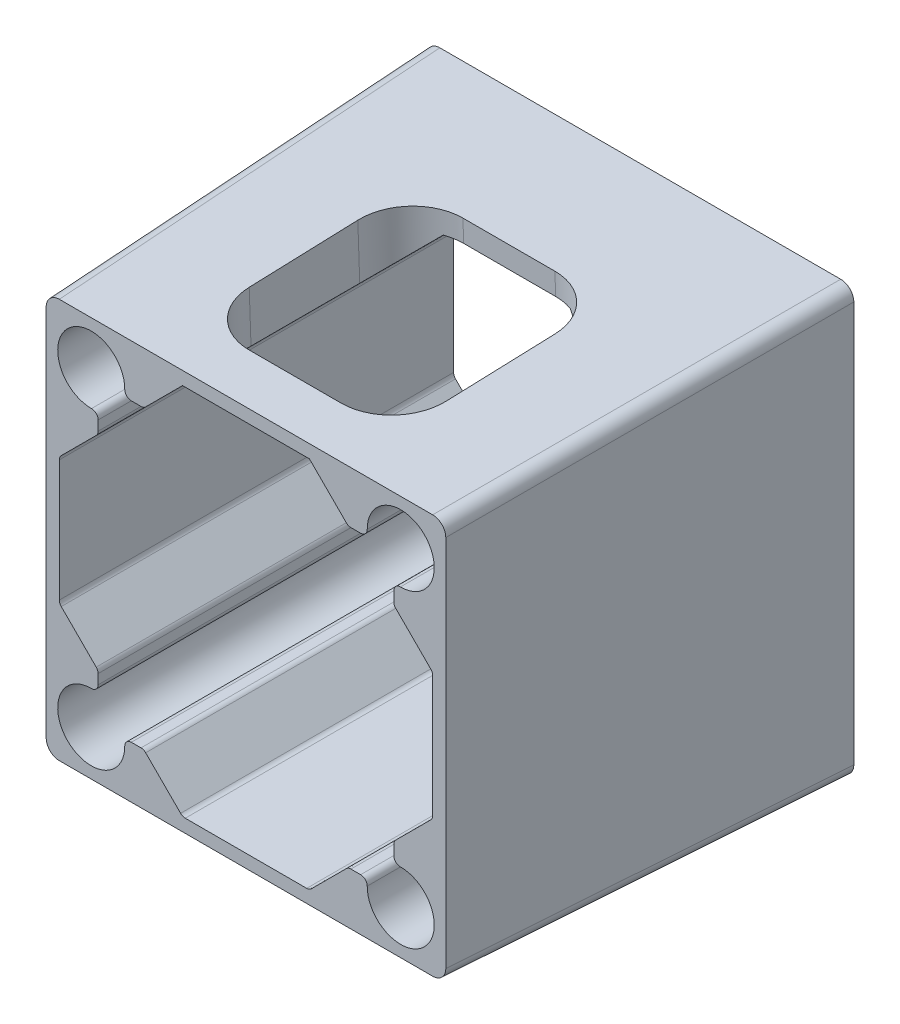
from build123d import *

# Parameters (mm, degrees)
SKETCH1_W           = 65
SKETCH1_H           = 65
BOSS_EXTRUDE1_DEPTH = 60
BOSS_EXTRUDE1_TAPER = 2
CUT_EXTRUDE1_REACH  = 77.581
SKETCH4_R           = 5.1
CUT_EXTRUDE2_REACH  = 77.581
SKETCH5_W           = 45
SKETCH5_H           = 45
CUT_EXTRUDE4_REACH  = 77.581
CUT_EXTRUDE5_REACH  = 95.495
SKETCH7_W           = 30
SKETCH7_H           = 32.536572658
FILLET1_R           = 2
FILLET3_R           = 1
FILLET5_R           = 8


with BuildPart() as part:
    # Sketch1 → Boss-Extrude1 (new body)
    with BuildSketch(Plane.XY):
        Rectangle(SKETCH1_W, SKETCH1_H)
    extrude(amount=BOSS_EXTRUDE1_DEPTH, taper=BOSS_EXTRUDE1_TAPER)

    # Sketch4 → Cut-Extrude1 (cut, up to next)
    with BuildSketch(Plane.XY.offset(60), mode=Mode.PRIVATE) as cut_extrude1_sk1:
        with Locations((-23.550191347, 23.550191347)):
            Circle(SKETCH4_R)
    cut_extrude1_tool1 = extrude(cut_extrude1_sk1.sketch, amount=-CUT_EXTRUDE1_REACH, mode=Mode.PRIVATE) & part.part
    # Sketch4 → Cut-Extrude1 (cut, up to next)
    with BuildSketch(Plane.XY.offset(60), mode=Mode.PRIVATE) as cut_extrude1_sk2:
        with Locations((23.550191347, 23.550191347)):
            Circle(SKETCH4_R)
    cut_extrude1_tool2 = extrude(cut_extrude1_sk2.sketch, amount=-CUT_EXTRUDE1_REACH, mode=Mode.PRIVATE) & part.part
    # Sketch4 → Cut-Extrude1 (cut, up to next)
    with BuildSketch(Plane.XY.offset(60), mode=Mode.PRIVATE) as cut_extrude1_sk3:
        with Locations((23.550191347, -23.550191347)):
            Circle(SKETCH4_R)
    cut_extrude1_tool3 = extrude(cut_extrude1_sk3.sketch, amount=-CUT_EXTRUDE1_REACH, mode=Mode.PRIVATE) & part.part
    # Sketch4 → Cut-Extrude1 (cut, up to next)
    with BuildSketch(Plane.XY.offset(60), mode=Mode.PRIVATE) as cut_extrude1_sk4:
        with Locations((-23.550191347, -23.550191347)):
            Circle(SKETCH4_R)
    cut_extrude1_tool4 = extrude(cut_extrude1_sk4.sketch, amount=-CUT_EXTRUDE1_REACH, mode=Mode.PRIVATE) & part.part
    add(cut_extrude1_tool1.solids().sort_by_distance((-23.550191, 23.550191, 60))[0], mode=Mode.SUBTRACT)
    add(cut_extrude1_tool2.solids().sort_by_distance((23.550191, 23.550191, 60))[0], mode=Mode.SUBTRACT)
    add(cut_extrude1_tool3.solids().sort_by_distance((23.550191, -23.550191, 60))[0], mode=Mode.SUBTRACT)
    add(cut_extrude1_tool4.solids().sort_by_distance((-23.550191, -23.550191, 60))[0], mode=Mode.SUBTRACT)

    # Sketch5 → Cut-Extrude2 (cut, up to next)
    with BuildSketch(Plane.XY.offset(60), mode=Mode.PRIVATE) as cut_extrude2_sk1:
        Rectangle(SKETCH5_W, SKETCH5_H)
    cut_extrude2_tool1 = extrude(cut_extrude2_sk1.sketch, amount=-CUT_EXTRUDE2_REACH, mode=Mode.PRIVATE) & part.part
    add(cut_extrude2_tool1.solids().sort_by_distance((0, 0, 60))[0], mode=Mode.SUBTRACT)

    # Sketch6 → Cut-Extrude4 (cut, up to next)
    with BuildSketch(Plane.XY.offset(60), mode=Mode.PRIVATE) as cut_extrude4_sk1:
        Polygon((-22.5, -15.559490181), (-22.5, 15.559490181), (-28.40475383, 9.65473635), (-28.40475383, -9.65473635), align=None)
    cut_extrude4_tool1 = extrude(cut_extrude4_sk1.sketch, amount=-CUT_EXTRUDE4_REACH, mode=Mode.PRIVATE) & part.part
    # Sketch6 → Cut-Extrude4 (cut, up to next)
    with BuildSketch(Plane.XY.offset(60), mode=Mode.PRIVATE) as cut_extrude4_sk2:
        Polygon((-15.559490181, 22.5), (15.559490181, 22.5), (9.65473635, 28.40475383), (-9.65473635, 28.40475383), align=None)
    cut_extrude4_tool2 = extrude(cut_extrude4_sk2.sketch, amount=-CUT_EXTRUDE4_REACH, mode=Mode.PRIVATE) & part.part
    # Sketch6 → Cut-Extrude4 (cut, up to next)
    with BuildSketch(Plane.XY.offset(60), mode=Mode.PRIVATE) as cut_extrude4_sk3:
        Polygon((22.5, 15.559490181), (22.5, -15.559490181), (28.40475383, -9.65473635), (28.40475383, 9.65473635), align=None)
    cut_extrude4_tool3 = extrude(cut_extrude4_sk3.sketch, amount=-CUT_EXTRUDE4_REACH, mode=Mode.PRIVATE) & part.part
    # Sketch6 → Cut-Extrude4 (cut, up to next)
    with BuildSketch(Plane.XY.offset(60), mode=Mode.PRIVATE) as cut_extrude4_sk4:
        Polygon((15.559490181, -22.5), (-15.559490181, -22.5), (-9.65473635, -28.40475383), (9.65473635, -28.40475383), align=None)
    cut_extrude4_tool4 = extrude(cut_extrude4_sk4.sketch, amount=-CUT_EXTRUDE4_REACH, mode=Mode.PRIVATE) & part.part
    add(cut_extrude4_tool1.solids().sort_by_distance((-25.221911, 0, 60))[0], mode=Mode.SUBTRACT)
    add(cut_extrude4_tool2.solids().sort_by_distance((0, 25.221911, 60))[0], mode=Mode.SUBTRACT)
    add(cut_extrude4_tool3.solids().sort_by_distance((25.221911, 0, 60))[0], mode=Mode.SUBTRACT)
    add(cut_extrude4_tool4.solids().sort_by_distance((0, -25.221911, 60))[0], mode=Mode.SUBTRACT)

    # Sketch7 → Cut-Extrude5 (cut, up to next)
    with BuildSketch(Plane(origin=(0, 32.460415817, 1.133542698), x_dir=(1, 0, 0), z_dir=(0, 0.9993908270190958, 0.034899496702501046)), mode=Mode.PRIVATE) as cut_extrude5_sk1:
        with Locations((0, -35.134052686)):
            Rectangle(SKETCH7_W, SKETCH7_H)
    cut_extrude5_tool1 = extrude(cut_extrude5_sk1.sketch, amount=-CUT_EXTRUDE5_REACH, mode=Mode.PRIVATE) & part.part
    add(cut_extrude5_tool1.solids().sort_by_distance((0, 31.234255, 36.246193))[0], mode=Mode.SUBTRACT)

    # Fillet1
    fillet1_edges = [part.edges().sort_by_distance(p)[0] for p in [
        (-31.452376453, 31.452376453, 30.000013228),
        (31.452376915, 31.452376915, 30),
        (31.452376453, -31.452376453, 30.000013228),
        (-31.452376915, -31.452376915, 30),
    ]]
    fillet(fillet1_edges, radius=FILLET1_R)

    # Fillet3
    fillet3_edges = [part.edges().sort_by_distance(p)[0] for p in [
        (-22.5, -15.559490181, 30),
        (-28.40475383, -9.65473635, 30),
        (-28.40475383, 9.65473635, 30),
        (-22.5, 15.559490181, 30),
        (-22.5, 18.559490181, 30),
        (-18.559490181, 22.5, 30),
        (18.559490181, 22.5, 30),
        (22.5, 18.559490181, 30),
        (22.5, -18.559490181, 30),
        (18.559490181, -22.5, 30),
        (-22.5, -18.559490181, 30),
        (-18.559490181, -22.5, 30),
        (15.559490181, -22.5, 30),
        (9.65473635, -28.40475383, 30),
        (-9.65473635, -28.40475383, 30),
        (-15.559490181, -22.5, 30),
        (-15.559490181, 22.5, 30),
        (15.559490181, 22.5, 30),
        (22.5, 15.559490181, 30),
        (28.40475383, 9.65473635, 30),
        (28.40475383, -9.65473635, 30),
        (22.5, -15.559490181, 30),
    ]]
    fillet(fillet3_edges, radius=FILLET3_R)

    # Fillet5
    fillet5_edges = [part.edges().sort_by_distance(p)[0] for p in [
        (15, 26.862995118, 52.371747478),
        (-15, 26.862995118, 52.371747478),
        (15, 27.430750123, 19.83516878),
        (-15, 27.430750123, 19.83516878),
    ]]
    fillet(fillet5_edges, radius=FILLET5_R)


solid = part.part
